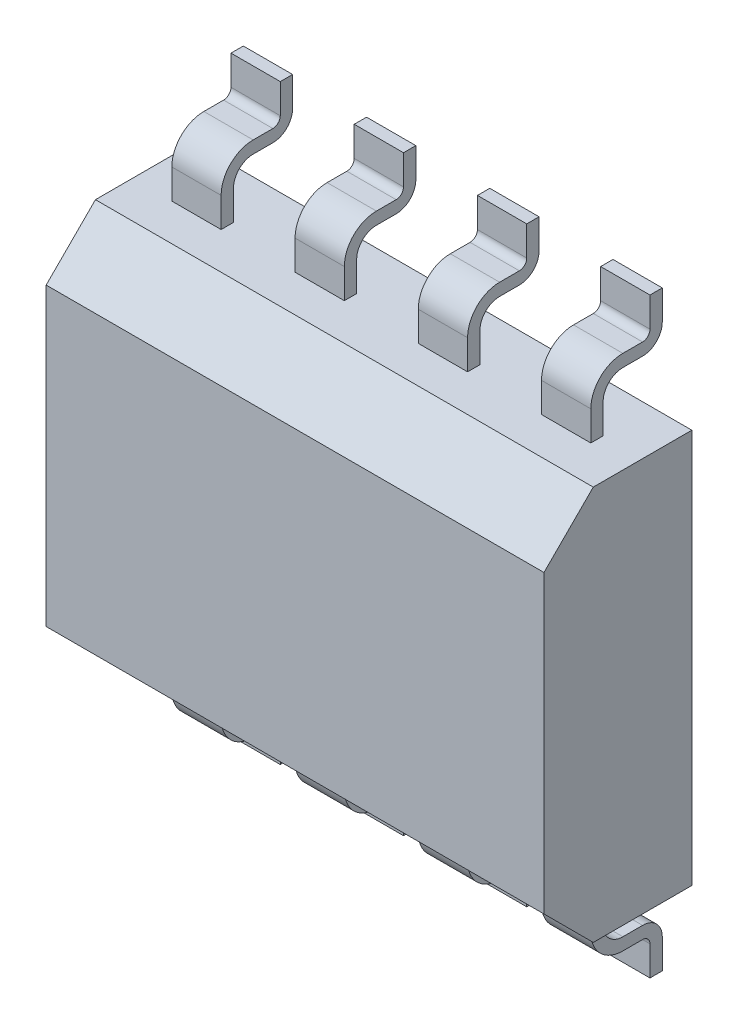
from build123d import *

# Parameters (mm, degrees)
SKETCH1_W               = 5.05
SKETCH1_H               = 4
EXTRUDE1_DEPTH          = 0.75
CHAMFER1_SIZE           = 0.5
SKETCH2_W               = 0.5
SKETCH2_H               = 0.125
LPATTERN1_COUNT         = 4
LPATTERN1_PITCH         = 1.25
MIRROR1_COPY_1_SKETCH_W = 0.5
MIRROR1_COPY_1_SKETCH_H = 0.125
MIRROR1_COPY_2_SKETCH_W = 0.5
MIRROR1_COPY_2_SKETCH_H = 0.125
MIRROR1_COPY_3_SKETCH_W = 0.5
MIRROR1_COPY_3_SKETCH_H = 0.125


with BuildPart() as part:
    # Sketch1 → Extrude1 (new, symmetric)
    with BuildSketch(Plane.XY):
        Rectangle(SKETCH1_W, SKETCH1_H)
    extrude(amount=EXTRUDE1_DEPTH, both=True)

    # Chamfer1
    chamfer1_edges = [part.edges().sort_by_distance(p)[0] for p in [
        (0, -2, 0.75),
        (0, 2, 0.75),
    ]]
    chamfer(chamfer1_edges, length=CHAMFER1_SIZE)

    # Sweep1: sweep along a path in Sketch3
    with BuildLine(Plane(origin=(2.125, 0, 0), x_dir=(0, 0, -1), z_dir=(1, 0, 0))) as sweep1_path:
        Line((0.85, 3), (0.85, 2.7))
        ThreePointArc((0.85, 2.7), (0.791421356, 2.558578644), (0.65, 2.5))
        Line((0.65, 2.5), (0.45, 2.5))
        ThreePointArc((0.45, 2.5), (0.308578644, 2.441421356), (0.25, 2.3))
        Line((0.25, 2.3), (0.25, 2))
    # Sketch2 → Sweep1 (sweep)
    with BuildSketch(Plane(origin=(0, 2, 0), x_dir=(1, 0, 0), z_dir=(0, 1, 0))):
        with Locations((1.875, 0.1875)):
            Rectangle(SKETCH2_W, SKETCH2_H)
    sweep1 = sweep(path=sweep1_path.line)

    # LPattern1: Sweep1 ×4
    with Locations(*[(-i * LPATTERN1_PITCH, 0, 0) for i in range(1, LPATTERN1_COUNT)]):
        add(sweep1)

    # Mirror1: Sweep1 across plane
    add(sweep1.mirror(Plane.ZX))

    # Mirror1 copy 1: sweep along a path in Mirror1 copy 1 path
    with BuildLine(Plane(origin=(0.875, 0, 0), x_dir=(0, 0, -1), z_dir=(1, 0, 0))) as mirror1_copy_1_path:
        Line((0.85, -3), (0.85, -2.7))
        ThreePointArc((0.85, -2.7), (0.791421356, -2.558578644), (0.65, -2.5))
        Line((0.65, -2.5), (0.45, -2.5))
        ThreePointArc((0.45, -2.5), (0.308578644, -2.441421356), (0.25, -2.3))
        Line((0.25, -2.3), (0.25, -2))
    # Mirror1 copy 1 sketch → Mirror1 copy 1 (sweep)
    with BuildSketch(Plane(origin=(-1.25, -2, 0), x_dir=(1, 0, 0), z_dir=(0, -1, 0))):
        with Locations((1.875, -0.1875)):
            Rectangle(MIRROR1_COPY_1_SKETCH_W, MIRROR1_COPY_1_SKETCH_H)
    sweep(path=mirror1_copy_1_path.line)

    # Mirror1 copy 2: sweep along a path in Mirror1 copy 2 path
    with BuildLine(Plane(origin=(-0.375, 0, 0), x_dir=(0, 0, -1), z_dir=(1, 0, 0))) as mirror1_copy_2_path:
        Line((0.85, -3), (0.85, -2.7))
        ThreePointArc((0.85, -2.7), (0.791421356, -2.558578644), (0.65, -2.5))
        Line((0.65, -2.5), (0.45, -2.5))
        ThreePointArc((0.45, -2.5), (0.308578644, -2.441421356), (0.25, -2.3))
        Line((0.25, -2.3), (0.25, -2))
    # Mirror1 copy 2 sketch → Mirror1 copy 2 (sweep)
    with BuildSketch(Plane(origin=(-2.5, -2, 0), x_dir=(1, 0, 0), z_dir=(0, -1, 0))):
        with Locations((1.875, -0.1875)):
            Rectangle(MIRROR1_COPY_2_SKETCH_W, MIRROR1_COPY_2_SKETCH_H)
    sweep(path=mirror1_copy_2_path.line)

    # Mirror1 copy 3: sweep along a path in Mirror1 copy 3 path
    with BuildLine(Plane(origin=(-1.625, 0, 0), x_dir=(0, 0, -1), z_dir=(1, 0, 0))) as mirror1_copy_3_path:
        Line((0.85, -3), (0.85, -2.7))
        ThreePointArc((0.85, -2.7), (0.791421356, -2.558578644), (0.65, -2.5))
        Line((0.65, -2.5), (0.45, -2.5))
        ThreePointArc((0.45, -2.5), (0.308578644, -2.441421356), (0.25, -2.3))
        Line((0.25, -2.3), (0.25, -2))
    # Mirror1 copy 3 sketch → Mirror1 copy 3 (sweep)
    with BuildSketch(Plane(origin=(-3.75, -2, 0), x_dir=(1, 0, 0), z_dir=(0, -1, 0))):
        with Locations((1.875, -0.1875)):
            Rectangle(MIRROR1_COPY_3_SKETCH_W, MIRROR1_COPY_3_SKETCH_H)
    sweep(path=mirror1_copy_3_path.line)


solid = part.part
